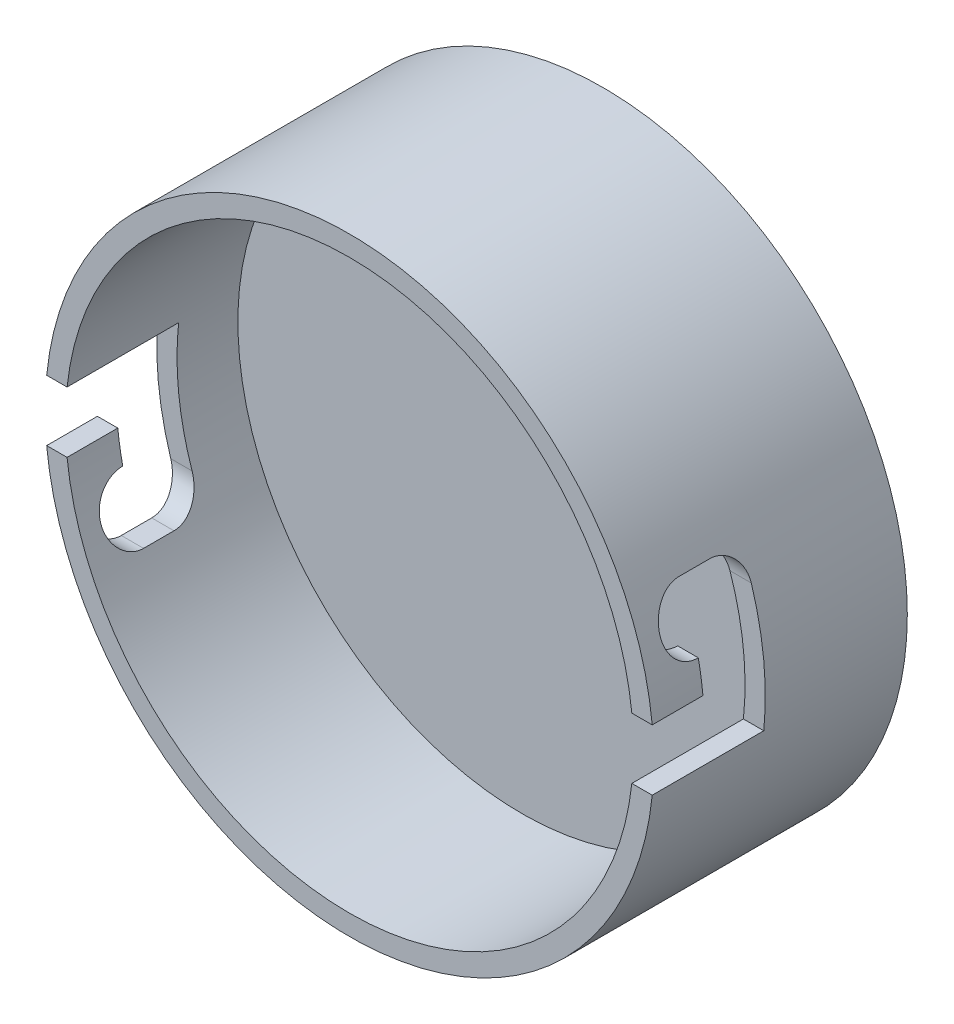
from build123d import *

# Parameters (mm, degrees)
SKETCH1_R           = 30
BOSS_EXTRUDE1_DEPTH = 8
SKETCH2_R           = 30
SKETCH2_R_2         = 28
BOSS_EXTRUDE2_DEPTH = 17
CUT_EXTRUDE1_DEPTH  = 39
CIRPATTERN1_COUNT   = 2
CIRPATTERN1_ANGLE   = 180
CUT_EXTRUDE2_DEPTH  = 4
SKETCH4_4_R         = 1.5
CUT_EXTRUDE3_DEPTH  = 20


with BuildPart() as part:
    # Sketch1 → Boss-Extrude1 (new body)
    with BuildSketch(Plane.XY):
        Circle(SKETCH1_R)
    extrude(amount=BOSS_EXTRUDE1_DEPTH)

    # Sketch2 → Boss-Extrude2 (add)
    with BuildSketch(Plane.XY.offset(8)):
        Circle(SKETCH2_R)
        Circle(SKETCH2_R_2, mode=Mode.SUBTRACT)
    extrude(amount=BOSS_EXTRUDE2_DEPTH)

    # Sketch3 → Cut-Extrude1 (cut)
    with BuildSketch(Plane(origin=(0, 0, 0), x_dir=(0, 0, -1), z_dir=(1, 0, 0))):
        with BuildLine():
            Line((-25, 3), (-20, 3))
            Line((-20, 3), (-14, 3))
            Line((-14, 3), (-14, -9))
            ThreePointArc((-14, -9), (-14.878679656, -11.121320344), (-17, -12))
            Line((-17, -12), (-20, -12))
            ThreePointArc((-20, -12), (-23, -9), (-20, -6))
            Line((-20, -6), (-20, -3))
            Line((-20, -3), (-25, -3))
            Line((-25, -3), (-25, 3))
        make_face()
    cut_extrude1 = extrude(amount=-CUT_EXTRUDE1_DEPTH, mode=Mode.SUBTRACT)

    # CirPattern1: Cut-Extrude1 ×2 about axis
    cirpattern1_axis = Axis((0, 0, 8), (0, 0, 1))
    for i in range(1, CIRPATTERN1_COUNT):
        add(cut_extrude1.rotate(cirpattern1_axis, i * CIRPATTERN1_ANGLE / (CIRPATTERN1_COUNT - 1)), mode=Mode.SUBTRACT)

    # Sketch4 → Cut-Extrude2 (cut)
    with BuildSketch(Plane(origin=(0, 0, 0), x_dir=(-1, 0, 0), z_dir=(0, 0, -1))):
        with BuildLine():
            Line((-3.375, 24), (-3.375, 12.024350294))
            ThreePointArc((-3.375, 12.024350294), (-4.02628005, 8.050346325), (-5.911981132, 4.49211577))
            ThreePointArc((-5.911981132, 4.49211577), (0, -7.425), (5.911981132, 4.49211577))
            ThreePointArc((5.911981132, 4.49211577), (4.02628005, 8.050346325), (3.375, 12.024350294))
            Line((3.375, 12.024350294), (3.375, 24))
            ThreePointArc((3.375, 24), (0, 27.375), (-3.375, 24))
        make_face()
    extrude(amount=-CUT_EXTRUDE2_DEPTH, mode=Mode.SUBTRACT)

    # Sketch4<4> → Cut-Extrude3 (cut)
    with BuildSketch(Plane(origin=(0, 0, 0), x_dir=(-1, 0, 0), z_dir=(0, 0, -1))):
        with Locations((0, 24)):
            Circle(SKETCH4_4_R)
        with Locations((0, 20)):
            Circle(SKETCH4_4_R)
    extrude(amount=-CUT_EXTRUDE3_DEPTH, mode=Mode.SUBTRACT)


solid = part.part
